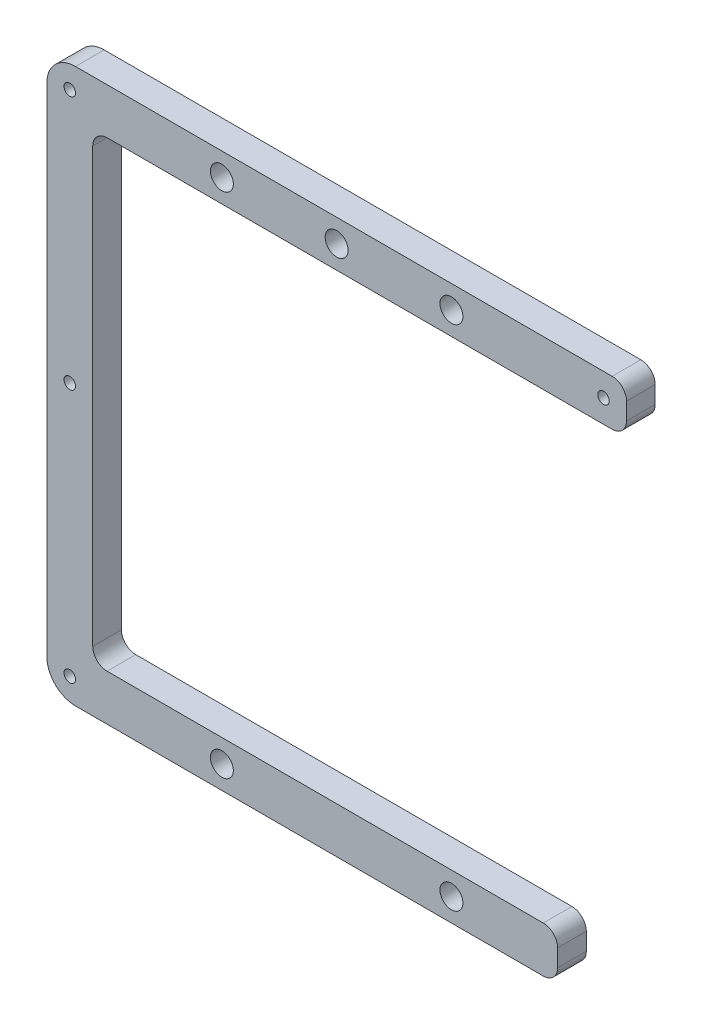
from build123d import *

# Parameters (mm, degrees)
BOSS_EXTRUDE1_DEPTH = 5
SKETCH4_R           = 2
CUT_EXTRUDE1_DEPTH  = 113.04491287
SKETCH5_R           = 1
CUT_EXTRUDE2_DEPTH  = 3


with BuildPart() as part:
    # Sketch1 → Boss-Extrude1 (new body)
    with BuildSketch(Plane.XY):
        with BuildLine():
            Line((0, -43.25), (0, 43.25))
            ThreePointArc((0, 43.25), (1.464466094, 46.785533906), (5, 48.25))
            Line((5, 48.25), (98.5, 48.25))
            ThreePointArc((98.5, 48.25), (100.267766953, 47.517766953), (101, 45.75))
            Line((101, 45.75), (101, 42.75))
            ThreePointArc((101, 42.75), (100.267766953, 40.982233047), (98.5, 40.25))
            Line((98.5, 40.25), (10.5, 40.25))
            ThreePointArc((10.5, 40.25), (8.732233047, 39.517766953), (8, 37.75))
            Line((8, 37.75), (8, -37.75))
            ThreePointArc((8, -37.75), (8.732233047, -39.517766953), (10.5, -40.25))
            Line((10.5, -40.25), (86.5, -40.25))
            ThreePointArc((86.5, -40.25), (88.267766953, -40.982233047), (89, -42.75))
            Line((89, -42.75), (89, -45.75))
            ThreePointArc((89, -45.75), (88.267766953, -47.517766953), (86.5, -48.25))
            Line((86.5, -48.25), (5, -48.25))
            ThreePointArc((5, -48.25), (1.464466094, -46.785533906), (0, -43.25))
        make_face()
    extrude(amount=BOSS_EXTRUDE1_DEPTH)

    # Sketch4 → Cut-Extrude1 (cut, through all)
    with BuildSketch(Plane.XY.offset(5)):
        with Locations((70.5, 44.25)):
            Circle(SKETCH4_R)
        with Locations((30.5, 44.25)):
            Circle(SKETCH4_R)
        with Locations(Location((70.5, -44.25, 0), (0, 0, 180))):
            Circle(SKETCH4_R)
        with Locations(Location((30.5, -44.25, 0), (0, 0, 180))):
            Circle(SKETCH4_R)
        with Locations((50.5, 44.25)):
            Circle(SKETCH4_R)
    extrude(amount=-CUT_EXTRUDE1_DEPTH, mode=Mode.SUBTRACT)

    # Sketch5 → Cut-Extrude2 (cut)
    with BuildSketch(Plane.XY.offset(5)):
        with Locations((4, 44.25)):
            Circle(SKETCH5_R)
        with Locations((4, 0)):
            Circle(SKETCH5_R)
        with Locations((4, -44.25)):
            Circle(SKETCH5_R)
        with Locations((97, 44.25)):
            Circle(SKETCH5_R)
    extrude(amount=-CUT_EXTRUDE2_DEPTH, mode=Mode.SUBTRACT)


solid = part.part
